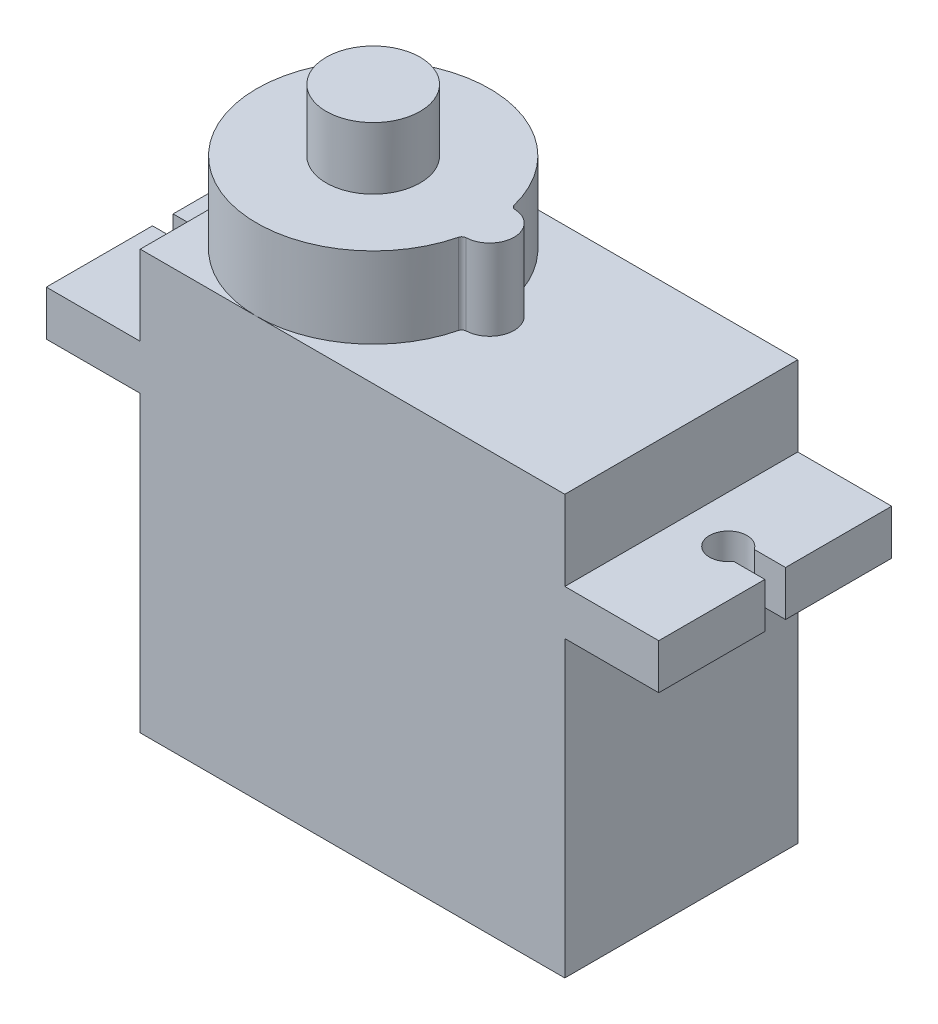
from build123d import *

# Parameters (mm, degrees)
SKETCH3_W             = 22.6
SKETCH3_H             = 12.4
BOSS_EXTRUDE1_DEPTH   = 22.3
SKETCH4_W             = 5
SKETCH4_H             = 2.4
BOSS_EXTRUDE2_DEPTH   = 12.4
CUT_EXTRUDE1_DEPTH    = 22.3
BOSS_EXTRUDE3_DEPTH   = 4.3
SKETCH8_R             = 2.5
BOSS_EXTRUDE4_DEPTH   = 3.3
SKETCH9_R             = 0.6
BOSS_EXTRUDE6_DEPTH   = 3.3
BOSS_EXTRUDE6_2_DEPTH = 3.3
BOSS_EXTRUDE6_3_DEPTH = 3.3


with BuildPart() as part:
    # Sketch3 → Boss-Extrude1 (new body)
    with BuildSketch(Plane(origin=(0, 0, 0), x_dir=(1, 0, 0), z_dir=(0, 1, 0))):
        Rectangle(SKETCH3_W, SKETCH3_H)
    extrude(amount=BOSS_EXTRUDE1_DEPTH)

    # Sketch4 → Boss-Extrude2 (add)
    with BuildSketch(Plane.XY.offset(6.2)):
        with Locations((13.8, 16.85)):
            Rectangle(SKETCH4_W, SKETCH4_H)
        with Locations((-13.8, 16.85)):
            Rectangle(SKETCH4_W, SKETCH4_H)
    extrude(amount=-BOSS_EXTRUDE2_DEPTH)

    # Sketch5 → Cut-Extrude1 (cut)
    with BuildSketch(Plane(origin=(0, 18.05, 0), x_dir=(1, 0, 0), z_dir=(0, 1, 0))):
        with BuildLine():
            Line((14.635164654, 0.55), (16.3, 0.55))
            Line((16.3, 0.55), (16.3, -0.55))
            Line((16.3, -0.55), (14.635164654, -0.55))
            ThreePointArc((14.635164654, -0.55), (12.8, 0), (14.635164654, 0.55))
        make_face()
    cut_extrude1 = extrude(amount=-CUT_EXTRUDE1_DEPTH, mode=Mode.SUBTRACT)

    # Mirror1: Cut-Extrude1 across plane
    add(cut_extrude1.mirror(Plane(origin=(0, 0, 0), x_dir=(0, 0, 1), z_dir=(1, 0, 0))), mode=Mode.SUBTRACT)

    # Sketch7 → Boss-Extrude3 (add)
    with BuildSketch(Plane(origin=(0, 22.3, 0), x_dir=(1, 0, 0), z_dir=(0, 1, 0))):
        with BuildLine():
            ThreePointArc((0.918604651, 1.488757218), (-11.3, 0), (0.918604651, -1.488757218))
            ThreePointArc((0.918604651, -1.488757218), (1.003329596, -1.355013632), (1.151404787, -1.298983275))
            ThreePointArc((1.151404787, -1.298983275), (2.4, 0), (1.151404787, 1.298983275))
            ThreePointArc((1.151404787, 1.298983275), (1.003329596, 1.355013632), (0.918604651, 1.488757218))
        make_face()
    extrude(amount=BOSS_EXTRUDE3_DEPTH)

    # Sketch8 → Boss-Extrude4 (add)
    with BuildSketch(Plane(origin=(0, 26.6, 0), x_dir=(1, 0, 0), z_dir=(0, 1, 0))):
        with Locations(Location((-5.1, 0, 0), (0, 0, 90))):
            Circle(SKETCH8_R)
    extrude(amount=BOSS_EXTRUDE4_DEPTH)


with BuildPart() as body_2:
    # Sketch9 → Boss-Extrude6 (new body)
    with BuildSketch(Plane.ZY.offset(11.3)):
        with Locations((-1.2, 4.5)):
            Circle(SKETCH9_R)
    extrude(amount=BOSS_EXTRUDE6_DEPTH)


with BuildPart() as body_3:
    # Sketch9 → Boss-Extrude6 2 (new body)
    with BuildSketch(Plane.ZY.offset(11.3)):
        with Locations((0, 4.5)):
            Circle(SKETCH9_R)
    extrude(amount=BOSS_EXTRUDE6_2_DEPTH)


with BuildPart() as body_4:
    # Sketch9 → Boss-Extrude6 3 (new body)
    with BuildSketch(Plane.ZY.offset(11.3)):
        with Locations((1.2, 4.5)):
            Circle(SKETCH9_R)
    extrude(amount=BOSS_EXTRUDE6_3_DEPTH)


solid = Compound([part.part, body_2.part, body_3.part, body_4.part])
